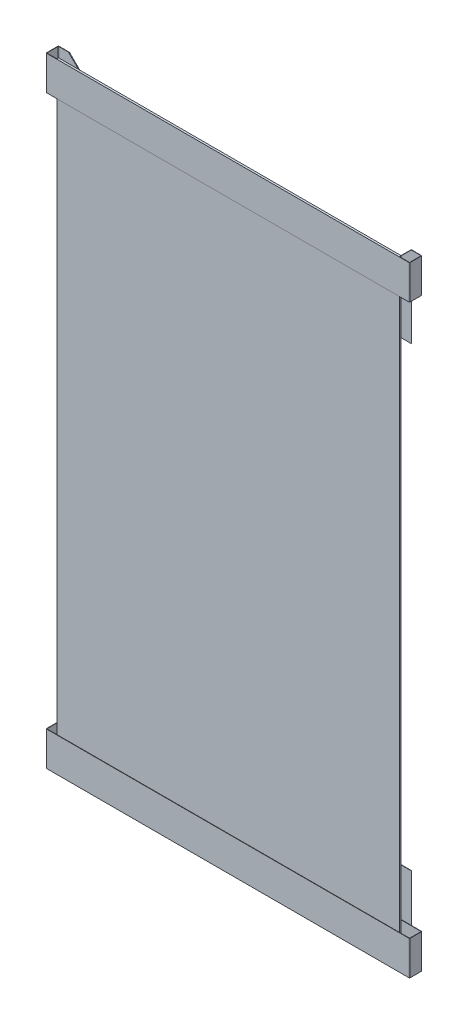
from build123d import *

# Parameters (mm, degrees)
SKETCH1_W            = 50
SKETCH1_H            = 88
BOSS_EXTRUDE1_DEPTH  = 0.25
BOSS_EXTRUDE2_DEPTH  = 5
SKETCH5_W            = 5
SKETCH5_H            = 11.9
BOSS_EXTRUDE3_DEPTH  = 0.05
CUT_EXTRUDE1_DEPTH   = 0.2
FILLET1_R            = 0.04
FILLET1_OF_MIRROR1_R = 0.04


with BuildPart() as part:
    # Sketch1 → Boss-Extrude1 (new body)
    with BuildSketch(Plane.XY.offset(0.25)):
        with Locations((0, 1.25)):
            Rectangle(SKETCH1_W, SKETCH1_H)
    extrude(amount=-BOSS_EXTRUDE1_DEPTH)

    # Sketch4 → Boss-Extrude2 (add)
    with BuildSketch(Plane(origin=(0, -45.25, 0), x_dir=(-1, 0, 0), z_dir=(0, -1, 0))):
        with BuildLine():
            Line((-26.45, -0.25), (26.45, -0.25))
            ThreePointArc((26.45, -0.25), (26.485355339, -0.235355339), (26.5, -0.2))
            Line((26.5, -0.2), (26.5, 1.4))
            ThreePointArc((26.5, 1.4), (26.485355339, 1.435355339), (26.45, 1.45))
            Line((26.45, 1.45), (20, 1.45))
            Line((20, 1.45), (20, 1.5))
            Line((20, 1.5), (26.5, 1.5))
            ThreePointArc((26.5, 1.5), (26.535355339, 1.485355339), (26.55, 1.45))
            Line((26.55, 1.45), (26.55, -0.25))
            ThreePointArc((26.55, -0.25), (26.535355339, -0.285355339), (26.5, -0.3))
            Line((26.5, -0.3), (-26.5, -0.3))
            ThreePointArc((-26.5, -0.3), (-26.535355339, -0.285355339), (-26.55, -0.25))
            Line((-26.55, -0.25), (-26.55, 1.45))
            ThreePointArc((-26.55, 1.45), (-26.535355339, 1.485355339), (-26.5, 1.5))
            Line((-26.5, 1.5), (-20, 1.5))
            Line((-20, 1.5), (-20, 1.45))
            Line((-20, 1.45), (-26.45, 1.45))
            ThreePointArc((-26.45, 1.45), (-26.485355339, 1.435355339), (-26.5, 1.4))
            Line((-26.5, 1.4), (-26.5, -0.2))
            ThreePointArc((-26.5, -0.2), (-26.485355339, -0.235355339), (-26.45, -0.25))
        make_face()
    boss_extrude2 = extrude(amount=-BOSS_EXTRUDE2_DEPTH)

    # Sketch5 → Boss-Extrude3 (add)
    with BuildSketch(Plane(origin=(0, 0, -1.5), x_dir=(-1, 0, 0), z_dir=(0, 0, -1))):
        with Locations((22.5, -39.3)):
            Rectangle(SKETCH5_W, SKETCH5_H)
        with Locations((-22.5, -39.3)):
            Rectangle(SKETCH5_W, SKETCH5_H)
    boss_extrude3 = extrude(amount=BOSS_EXTRUDE3_DEPTH)

    # Sketch6 → Cut-Extrude1 (cut)
    with BuildSketch(Plane(origin=(0, 0, -1.55), x_dir=(-1, 0, 0), z_dir=(0, 0, -1))):
        Polygon((20, -45.25), (25, -45.25), (20, -40.254912883), align=None)
        Polygon((-20, -40.254912883), (-25, -45.25), (-20, -45.25), align=None)
    cut_extrude1 = extrude(amount=-CUT_EXTRUDE1_DEPTH, mode=Mode.SUBTRACT)

    # Fillet1
    fillet1_edges = [part.edges().sort_by_distance(p)[0] for p in [
        (-22.5, -42.752456442, -1.45),
        (-22.5, -42.752456442, -1.55),
        (22.5, -42.752456442, -1.55),
        (22.5, -42.752456442, -1.45),
    ]]
    fillet(fillet1_edges, radius=FILLET1_R)

    # Mirror1: Boss-Extrude2, Boss-Extrude3, Cut-Extrude1 across plane
    add(boss_extrude2.mirror(Plane(origin=(0, 0, 0), x_dir=(0, 0, 1), z_dir=(0, -1, 0))))
    add(boss_extrude3.mirror(Plane(origin=(0, 0, 0), x_dir=(0, 0, 1), z_dir=(0, -1, 0))))
    add(cut_extrude1.mirror(Plane(origin=(0, 0, 0), x_dir=(0, 0, 1), z_dir=(0, -1, 0))), mode=Mode.SUBTRACT)

    # Fillet1 of Mirror1
    fillet1_of_mirror1_edges = [part.edges().sort_by_distance(p)[0] for p in [
        (-22.5, 42.752456442, -1.45),
        (-22.5, 42.752456442, -1.55),
        (22.5, 42.752456442, -1.55),
        (22.5, 42.752456442, -1.45),
    ]]
    fillet(fillet1_of_mirror1_edges, radius=FILLET1_OF_MIRROR1_R)


solid = part.part
